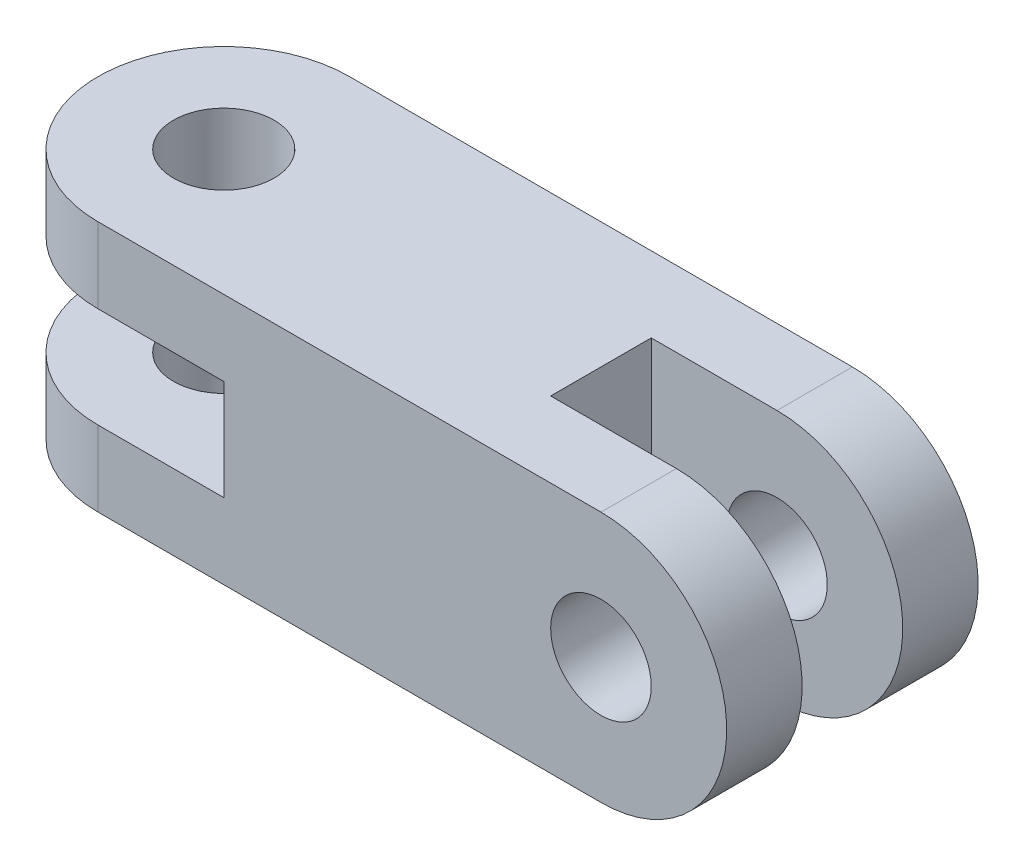
from build123d import *

# Parameters (mm, degrees)
SKETCH1_R           = 10
BOSS_EXTRUDE1_DEPTH = 50
SKETCH3_W           = 25
SKETCH3_H           = 20
SKETCH3_R           = 10
CUT_EXTRUDE2_DEPTH  = 144.614066163


with BuildPart() as part:
    # Sketch1 → Boss-Extrude1 (new body)
    with BuildSketch(Plane.XY):
        with BuildLine():
            Line((0, 25), (-125, 25))
            Line((-125, 25), (-125, 10))
            Line((-125, 10), (-75, 10))
            Line((-75, 10), (-75, -10))
            Line((-75, -10), (-125, -10))
            Line((-125, -10), (-125, -25))
            Line((-125, -25), (0, -25))
            ThreePointArc((0, -25), (25, 0), (0, 25))
        make_face()
        Circle(SKETCH1_R, mode=Mode.SUBTRACT)
    extrude(amount=BOSS_EXTRUDE1_DEPTH)

    # Sketch3 → Cut-Extrude2 (cut, through all)
    with BuildSketch(Plane.XZ.offset(25)):
        with BuildLine():
            Line((-125, 50), (-125, 25))
            ThreePointArc((-125, 25), (-117.67766953, 42.67766953), (-100, 50))
            Line((-100, 50), (-125, 50))
        make_face()
        with BuildLine():
            Line((-125, 0), (-100, 0))
            ThreePointArc((-100, 0), (-117.67766953, 7.32233047), (-125, 25))
            Line((-125, 25), (-125, 0))
        make_face()
        with Locations((12.5, 25)):
            Rectangle(SKETCH3_W, SKETCH3_H)
        with Locations((-12.5, 25)):
            Rectangle(SKETCH3_W, SKETCH3_H)
        with Locations((-100, 25)):
            Circle(SKETCH3_R)
    extrude(amount=-CUT_EXTRUDE2_DEPTH, mode=Mode.SUBTRACT)


solid = part.part
